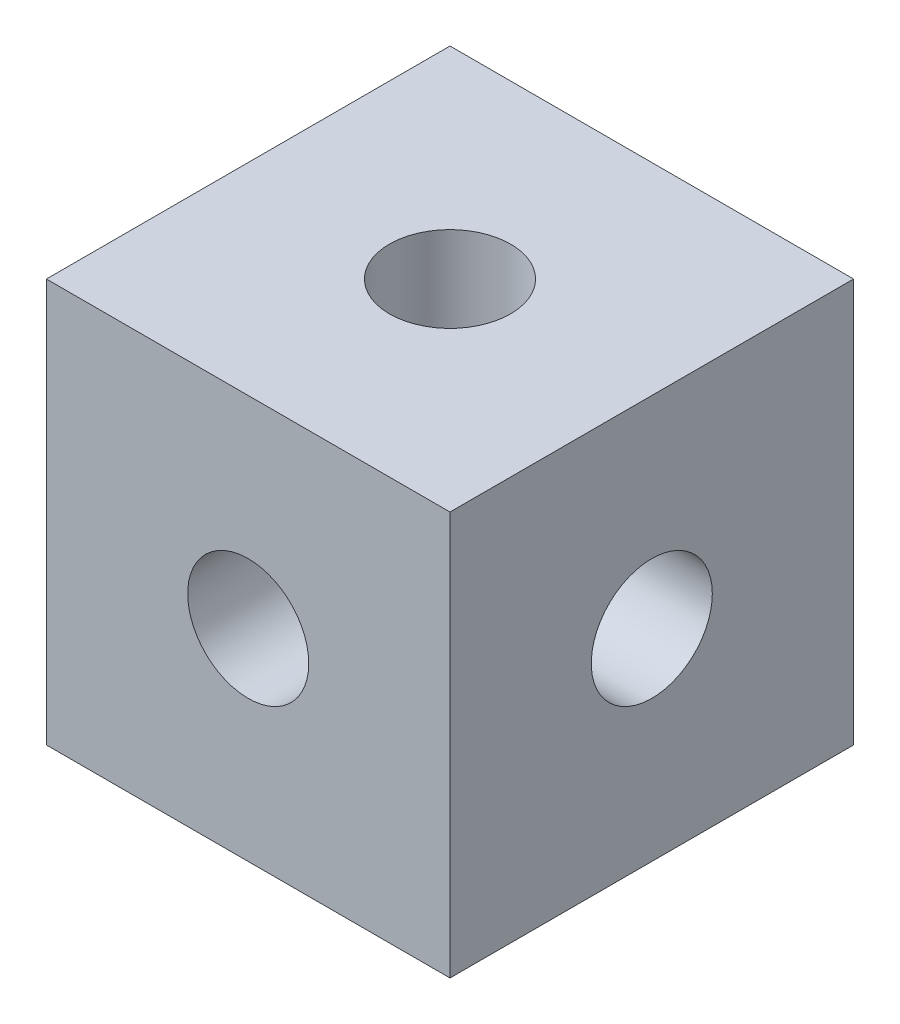
from build123d import *

# Parameters (mm, degrees)
SKETCH_1_W          = 10
SKETCH_1_H          = 10
EXTRUDE_1_DEPTH     = 10
SKETCH_2_R          = 1.5
CUT_EXTRUDE_1_DEPTH = 18.320508076
SKETCH_3_R          = 1.5
CUT_EXTRUDE_2_DEPTH = 18.320508076
SKETCH_4_R          = 1.5
CUT_EXTRUDE_3_DEPTH = 18.320508076


with BuildPart() as part:
    # 草图1 → 凸台-拉伸1 (new body)
    with BuildSketch(Plane(origin=(0, 0, 0), x_dir=(1, 0, 0), z_dir=(0, 1, 0))):
        with Locations((5, 5)):
            Rectangle(SKETCH_1_W, SKETCH_1_H)
    extrude(amount=EXTRUDE_1_DEPTH)

    # 草图2 → 切除-拉伸1 (cut, through all)
    with BuildSketch(Plane.XY):
        with Locations((5, 5)):
            Circle(SKETCH_2_R)
    extrude(amount=-CUT_EXTRUDE_1_DEPTH, mode=Mode.SUBTRACT)

    # 草图3 → 切除-拉伸2 (cut, through all)
    with BuildSketch(Plane(origin=(10, 0, 0), x_dir=(0, 0, -1), z_dir=(1, 0, 0))):
        with Locations((5, 5)):
            Circle(SKETCH_3_R)
    extrude(amount=-CUT_EXTRUDE_2_DEPTH, mode=Mode.SUBTRACT)

    # 草图4 → 切除-拉伸3 (cut, through all)
    with BuildSketch(Plane(origin=(0, 10, 0), x_dir=(1, 0, 0), z_dir=(0, 1, 0))):
        with Locations(Location((5, 5, 0), (0, 0, 270))):
            Circle(SKETCH_4_R)
    extrude(amount=-CUT_EXTRUDE_3_DEPTH, mode=Mode.SUBTRACT)


solid = part.part
